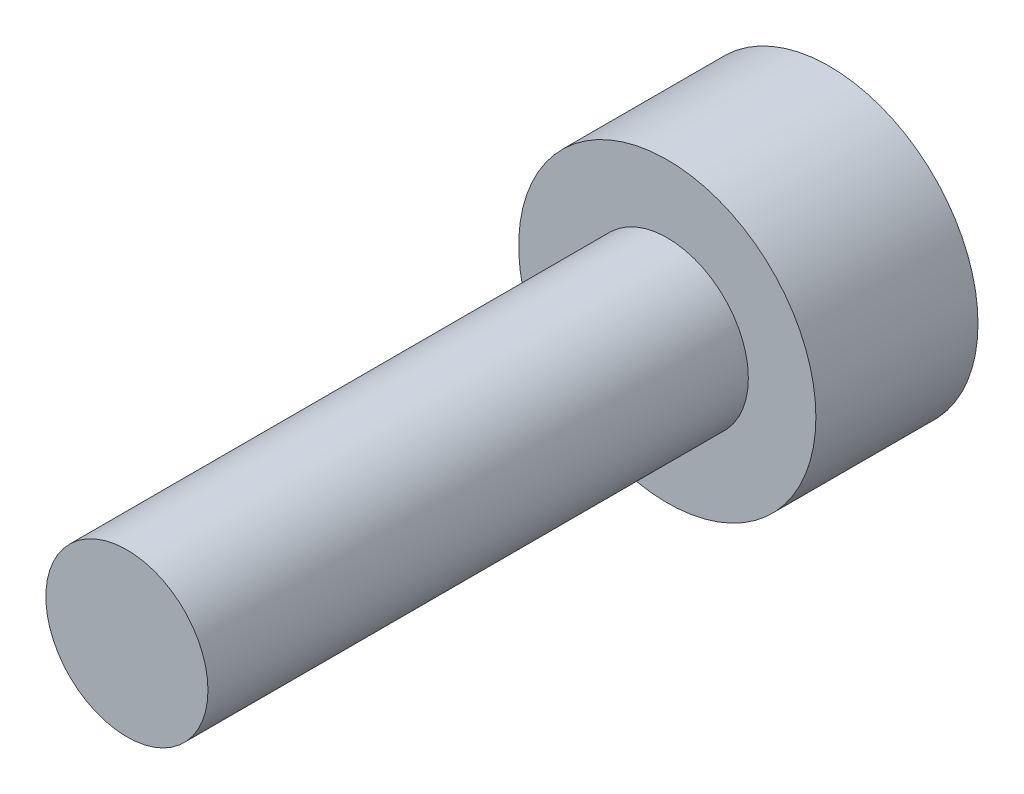
from build123d import *

# Parameters (mm, degrees)
CABEZA_START            = -3
SK_CABEZA_R             = 2.75
CABEZA_DEPTH            = 3
SK_CUERPO_R             = 1.5
CUERPO_DEPTH            = 10
HEXAGONO_INTERIOR_START = -3
HEXAGONO_INTERIOR_DEPTH = 1.5


with BuildPart() as part:
    # Sk_Cabeza → Cabeza (new body)
    with BuildSketch(Plane.XY.offset(CABEZA_START)):
        Circle(SK_CABEZA_R)
    extrude(amount=CABEZA_DEPTH)

    # Sk_Cuerpo → Cuerpo (add)
    with BuildSketch(Plane.XY):
        Circle(SK_CUERPO_R)
    extrude(amount=CUERPO_DEPTH)

    # Sk_Hexagono_interior → Hexagono_interior (cut)
    with BuildSketch(Plane.XY.offset(HEXAGONO_INTERIOR_START)):
        Polygon((0, -1.443375673), (1.25, -0.721687836), (1.25, 0.721687836), (0, 1.443375673), (-1.25, 0.721687836), (-1.25, -0.721687836), align=None)
    extrude(amount=HEXAGONO_INTERIOR_DEPTH, mode=Mode.SUBTRACT)


solid = part.part
